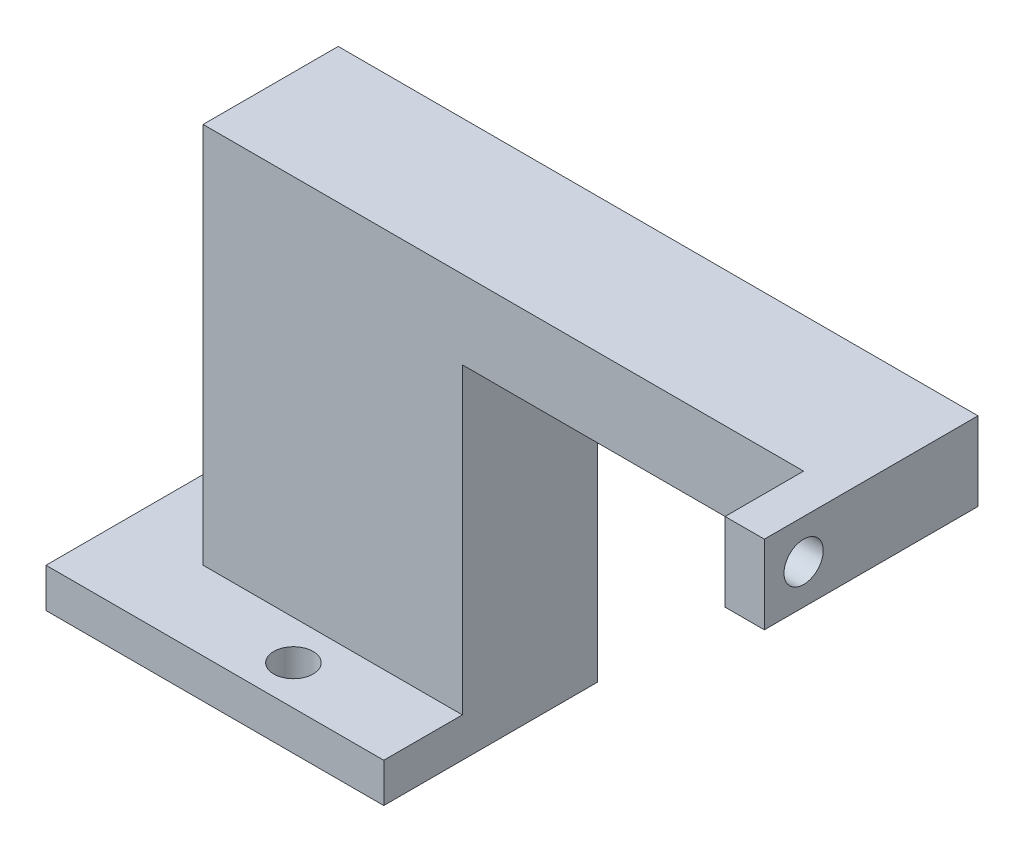
from build123d import *

# Parameters (mm, degrees)
SKIZZE1_W                       = 33
SKIZZE1_H                       = 17.2
AUFSATZ_LINEAR_AUSTRAGEN1_DEPTH = 53.6
SKIZZE2_W                       = 17.2
SKIZZE2_H                       = 10
AUFSATZ_LINEAR_AUSTRAGEN2_DEPTH = 48.45
SKIZZE3_W                       = 33
SKIZZE3_H                       = 5
SKIZZE3_W_2                     = 5
SKIZZE3_H_2                     = 10
AUFSATZ_LINEAR_AUSTRAGEN3_DEPTH = 10
SKIZZE4_W                       = 27.2
SKIZZE4_H                       = 5
AUFSATZ_LINEAR_AUSTRAGEN4_DEPTH = 10
SKIZZE5_R                       = 2.5
SCHNITT_LINEAR_AUSTRAGEN1_DEPTH = 10
SKIZZE6_R                       = 2.5
SCHNITT_LINEAR_AUSTRAGEN2_DEPTH = 10


with BuildPart() as part:
    # Skizze1 → Aufsatz-Linear austragen1 (new body)
    with BuildSketch(Plane(origin=(0, 0, 0), x_dir=(1, 0, 0), z_dir=(0, 1, 0))):
        with Locations((-6.27, -0.7625)):
            Rectangle(SKIZZE1_W, SKIZZE1_H)
    extrude(amount=AUFSATZ_LINEAR_AUSTRAGEN1_DEPTH)

    # Skizze2 → Aufsatz-Linear austragen2 (add)
    with BuildSketch(Plane(origin=(10.23, 0, 0), x_dir=(0, 0, -1), z_dir=(1, 0, 0))):
        with Locations((-0.7625, 48.6)):
            Rectangle(SKIZZE2_W, SKIZZE2_H)
    extrude(amount=AUFSATZ_LINEAR_AUSTRAGEN2_DEPTH)

    # Skizze3 → Aufsatz-Linear austragen3 (add)
    with BuildSketch(Plane.XY.offset(9.3625)):
        with Locations((-6.27, 2.5)):
            Rectangle(SKIZZE3_W, SKIZZE3_H)
        with Locations((56.18, 48.6)):
            Rectangle(SKIZZE3_W_2, SKIZZE3_H_2)
    extrude(amount=AUFSATZ_LINEAR_AUSTRAGEN3_DEPTH)

    # Skizze4 → Aufsatz-Linear austragen4 (add)
    with BuildSketch(Plane.ZY.offset(22.77)):
        with Locations((5.7625, 2.5)):
            Rectangle(SKIZZE4_W, SKIZZE4_H)
    extrude(amount=AUFSATZ_LINEAR_AUSTRAGEN4_DEPTH)

    # Skizze5 → Schnitt-Linear austragen1 (cut)
    with BuildSketch(Plane.ZY.offset(-53.68)):
        with Locations((14.3625, 48.6)):
            Circle(SKIZZE5_R)
    extrude(amount=-SCHNITT_LINEAR_AUSTRAGEN1_DEPTH, mode=Mode.SUBTRACT)

    # Skizze6 → Schnitt-Linear austragen2 (cut)
    with BuildSketch(Plane(origin=(0, 5, 0), x_dir=(1, 0, 0), z_dir=(0, 1, 0))):
        with Locations(Location((-27.77, 0, 0), (0, 0, 180))):
            Circle(SKIZZE6_R)
        with Locations(Location((-6.27, -14.3625, 0), (0, 0, 180))):
            Circle(SKIZZE6_R)
    extrude(amount=-SCHNITT_LINEAR_AUSTRAGEN2_DEPTH, mode=Mode.SUBTRACT)


solid = part.part
